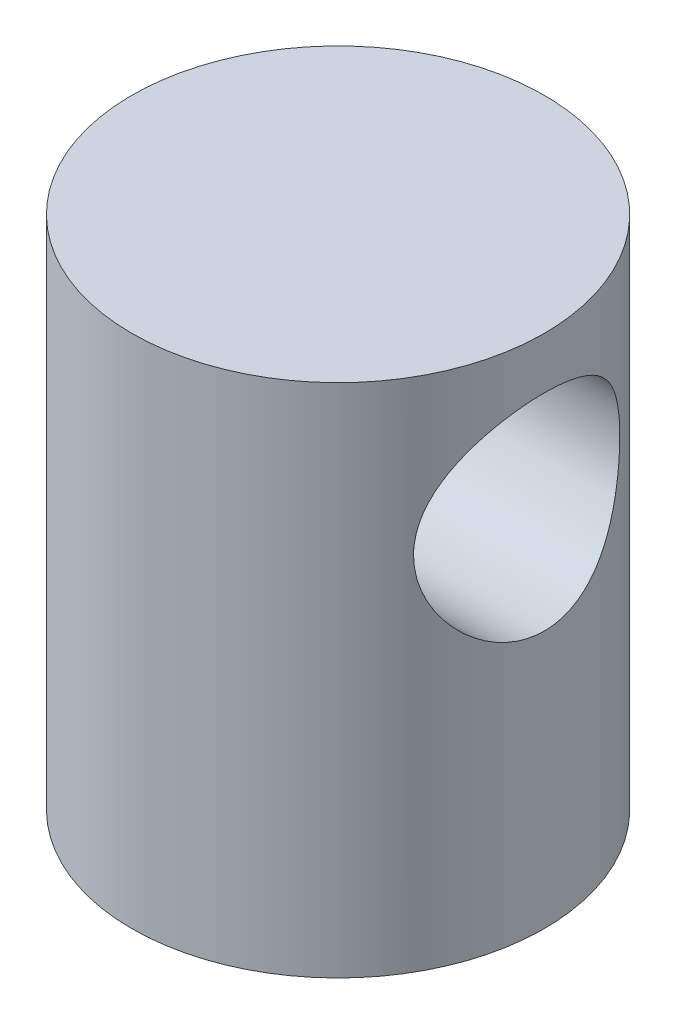
from build123d import *

# Parameters (mm, degrees)
SKETCH1_R               = 20
BOSS_EXTRUDE1_DEPTH     = 50
CUT_EXTRUDE1_DEPTH      = 50
CUT_EXTRUDE1_DEPTH_BACK = 50
SKETCH2_R               = 10


with BuildPart() as part:
    # Sketch1 → Boss-Extrude1 (new body)
    with BuildSketch(Plane(origin=(0, 0, 0), x_dir=(1, 0, 0), z_dir=(0, 1, 0))):
        Circle(SKETCH1_R)
    extrude(amount=BOSS_EXTRUDE1_DEPTH)

    # Sketch2 → Cut-Extrude1 (cut, two sides: drawn at the far end of the back side and taken through both)
    with BuildSketch(Plane(origin=(0, 0, 0), x_dir=(0, 0, -1), z_dir=(1, 0, 0)).offset(-CUT_EXTRUDE1_DEPTH_BACK)):
        with Locations((0, 35)):
            Circle(SKETCH2_R)
    extrude(amount=CUT_EXTRUDE1_DEPTH + CUT_EXTRUDE1_DEPTH_BACK, mode=Mode.SUBTRACT)


solid = part.part
